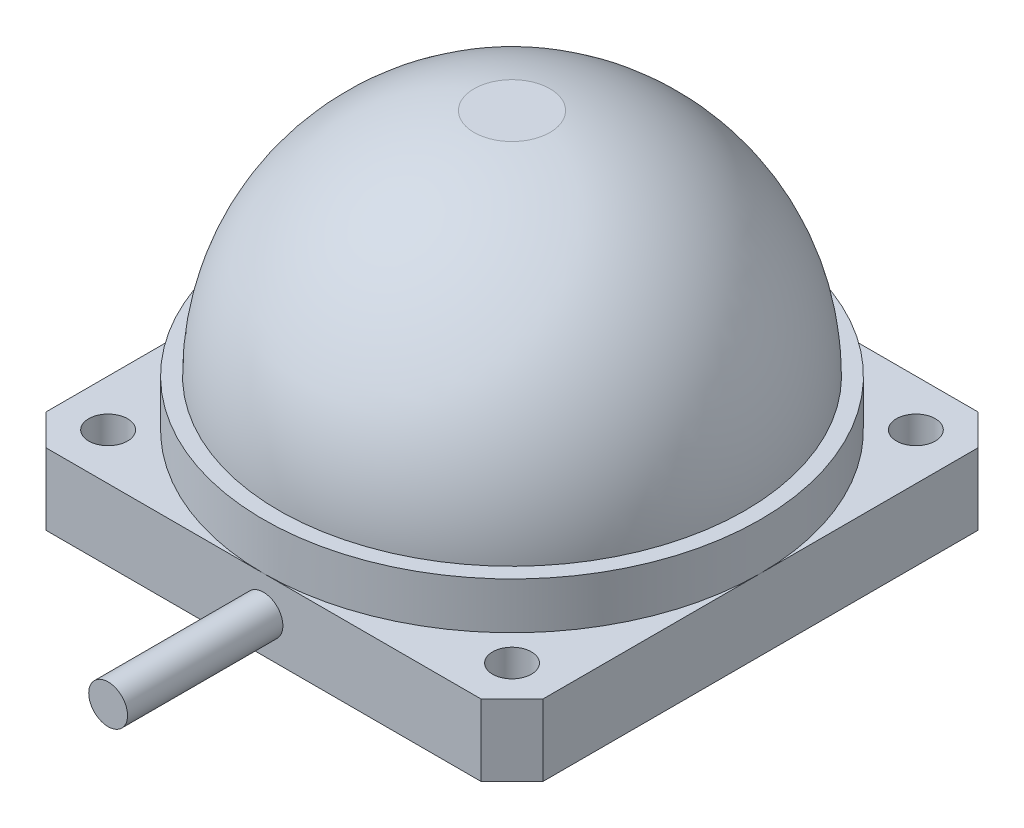
from build123d import *

# Parameters (mm, degrees)
SKETCH2_R             = 16
BOSS_EXTRUDE1_DEPTH   = 3
SKETCH3_W             = 32
SKETCH3_H             = 32
BOSS_EXTRUDE2_DEPTH   = 4.6
F_2_5MM_DOWEL_HOLE1_D = 2.5
CHAMFER1_SIZE         = 2
SKETCH11_R            = 1.25
BOSS_EXTRUDE3_DEPTH   = 10
SKETCH12_R            = 16
CUT_EXTRUDE1_DEPTH    = 38.865023439


with BuildPart() as part:
    # Sketch1 → Revolve1 (revolve)
    with BuildSketch(Plane.XY):
        with BuildLine():
            Line((0, 0), (15, 0))
            ThreePointArc((15, 0), (10.606601718, 10.606601718), (0, 15))
            Line((0, 15), (0, 0))
        make_face()
    revolve(axis=Axis((0, 15, 0), (0, -1, 0)))

    # Sketch2 → Boss-Extrude1 (add)
    with BuildSketch(Plane.XZ):
        Circle(SKETCH2_R)
    extrude(amount=BOSS_EXTRUDE1_DEPTH)

    # Sketch3 → Boss-Extrude2 (add)
    with BuildSketch(Plane.XZ.offset(3)):
        Rectangle(SKETCH3_W, SKETCH3_H)
    extrude(amount=BOSS_EXTRUDE2_DEPTH)

    # Ø2.5mm Dowel Hole1 (through all)
    with Locations(Plane(origin=(0, -3, 0), x_dir=(1, 0, 0), z_dir=(0, 1, 0))):
        with Locations((-13, 13), (13, -13), (13, 13), (-13, -13)):
            Hole(F_2_5MM_DOWEL_HOLE1_D / 2)

    # Chamfer1
    chamfer1_edges = [part.edges().sort_by_distance(p)[0] for p in [
        (16, -5.3, -16),
        (16, -5.3, 16),
        (-16, -5.3, 16),
        (-16, -5.3, -16),
    ]]
    chamfer(chamfer1_edges, length=CHAMFER1_SIZE)

    # Sketch11 → Boss-Extrude3 (add)
    with BuildSketch(Plane.XY.offset(16)):
        with Locations(Location((0, -5.3, 0), (0, 0, 180))):
            Circle(SKETCH11_R)
    extrude(amount=BOSS_EXTRUDE3_DEPTH)

    # Sketch12 → Cut-Extrude1 (cut, through all)
    with BuildSketch(Plane(origin=(0, 14.8, 0), x_dir=(1, 0, 0), z_dir=(0, 1, 0))):
        Circle(SKETCH12_R)
    extrude(amount=CUT_EXTRUDE1_DEPTH, mode=Mode.SUBTRACT)


solid = part.part
